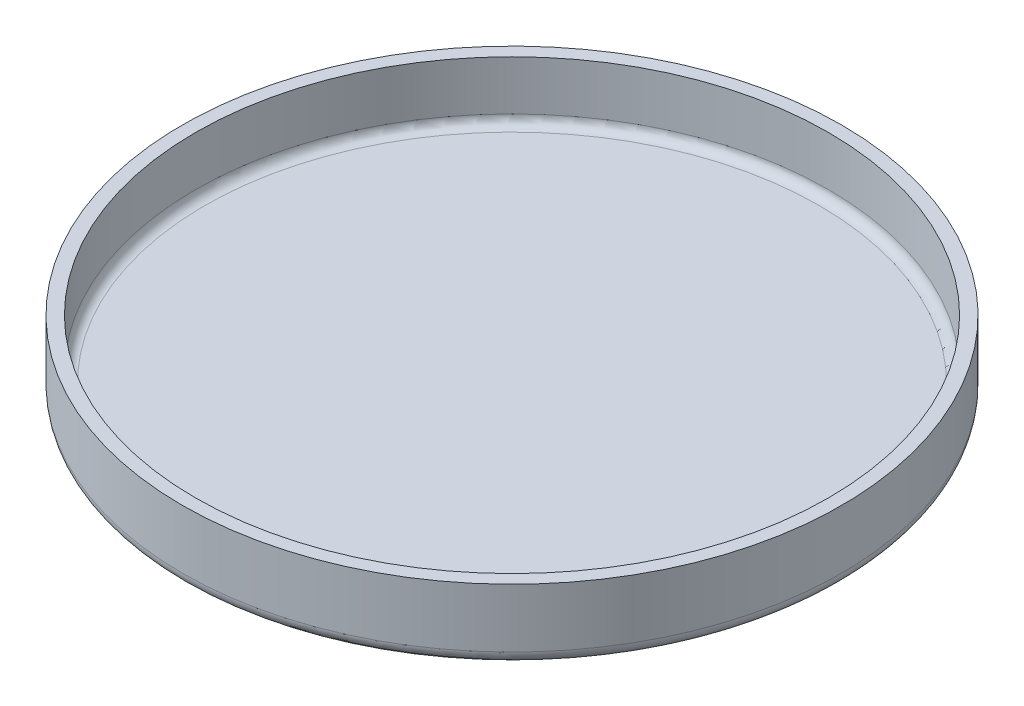
from build123d import *


with BuildPart() as part:
    # Croquis1 → Revolución1 (revolve)
    with BuildSketch(Plane.XY, mode=Mode.PRIVATE) as revoluci_n1_sk:
        with BuildLine():
            Line((48.5, 0), (0, 0))
            Line((0, 0), (0, 2))
            Line((0, 2), (47.085786438, 2))
            ThreePointArc((47.085786438, 2), (48.085786438, 2.414213562), (48.5, 3.414213562))
            Line((48.5, 3.414213562), (48.5, 11))
            Line((48.5, 11), (50.5, 11))
            Line((50.5, 11), (50.5, 2))
            ThreePointArc((50.5, 2), (49.914213562, 0.585786438), (48.5, 0))
        make_face()
    revolve(revoluci_n1_sk.sketch.rotate(Axis((0, 0, 0), (0, 1, 0)), 90), axis=Axis((0, 0, 0), (0, 1, 0)))


solid = part.part
